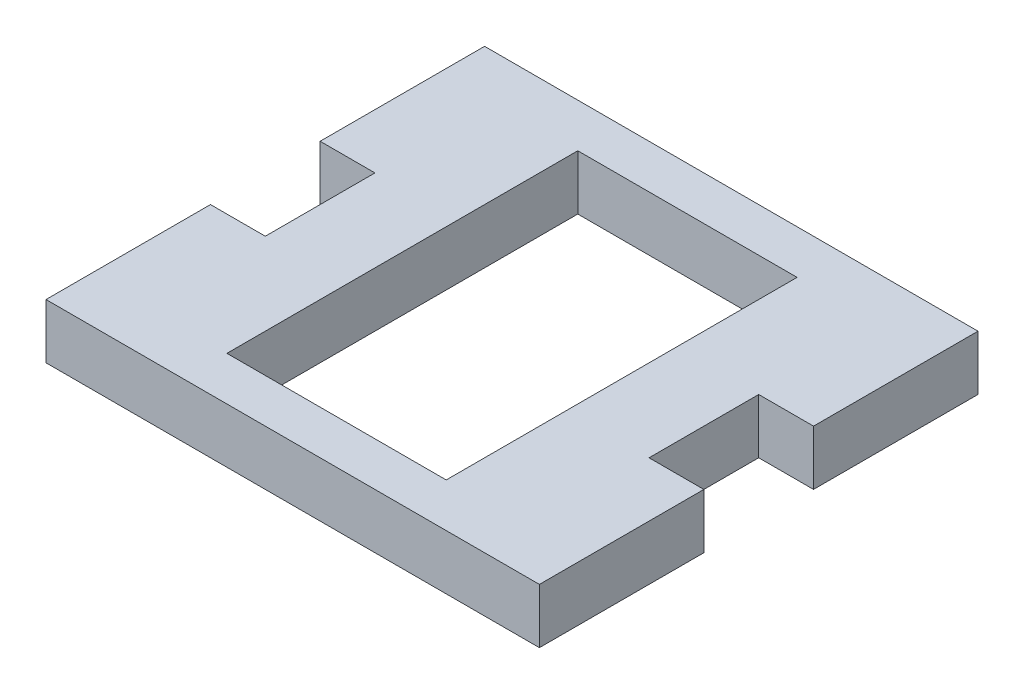
from build123d import *

# Parameters (mm, degrees)
SKETCH1_W           = 12.7
SKETCH1_H           = 20.32
BOSS_EXTRUDE1_DEPTH = 3.175


with BuildPart() as part:
    # Sketch1 → Boss-Extrude1 (new body)
    with BuildSketch(Plane(origin=(0, 0, 0), x_dir=(1, 0, 0), z_dir=(0, 1, 0))):
        Polygon((-14.2875, 3.175), (-11.1125, 3.175), (-11.1125, -3.175), (-14.2875, -3.175), (-14.2875, -12.7), (14.2875, -12.7), (14.2875, -3.175), (11.1125, -3.175), (11.1125, 3.175), (14.2875, 3.175), (14.2875, 12.7), (-14.2875, 12.7), align=None)
        Rectangle(SKETCH1_W, SKETCH1_H, mode=Mode.SUBTRACT)
    extrude(amount=BOSS_EXTRUDE1_DEPTH)


solid = part.part
